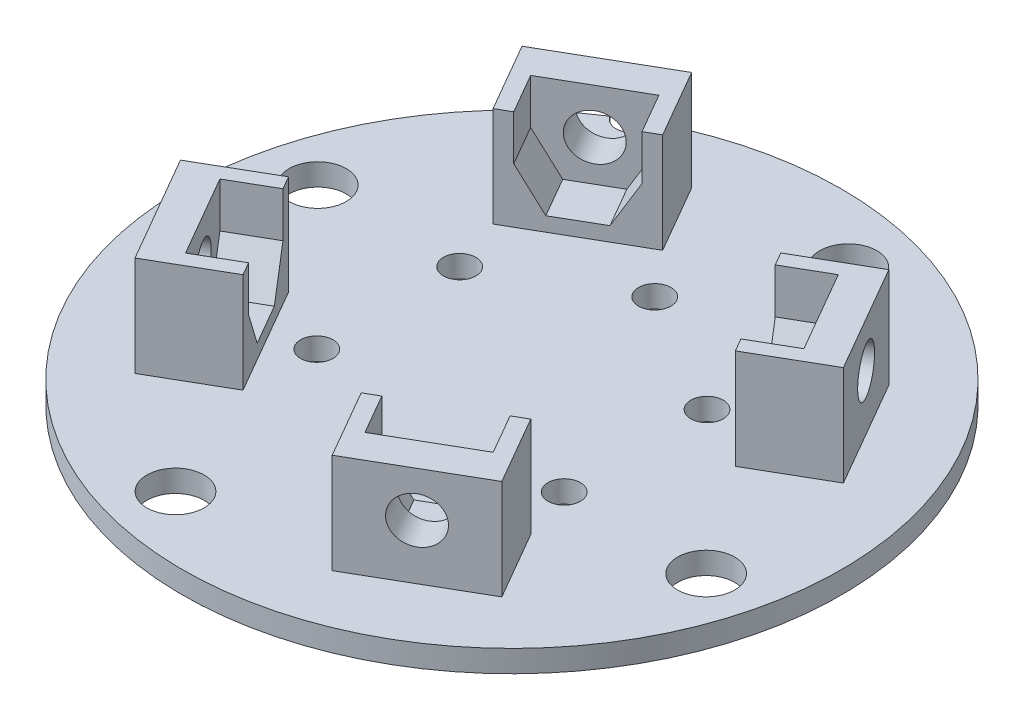
from build123d import *

# Parameters (mm, degrees)
SKETCH1_R           = 30
SKETCH1_R_2         = 1.475
SKETCH1_R_3         = 2.6
BOSS_EXTRUDE1_DEPTH = 2
SKETCH2_R           = 1.5
CUT_EXTRUDE1_DEPTH  = 10
BOSS_EXTRUDE3_DEPTH = 9.1
CIRPATTERN1_COUNT   = 4
CUT_EXTRUDE2_START  = -3
CUT_EXTRUDE2_DEPTH  = 5
CUT_EXTRUDE3_DEPTH  = 15
CIRPATTERN2_COUNT   = 4
CIRPATTERN3_COUNT   = 4


with BuildPart() as part:
    # Sketch1 → Boss-Extrude1 (new body)
    with BuildSketch(Plane(origin=(0, 0, 0), x_dir=(1, 0, 0), z_dir=(0, 1, 0))):
        with Locations(Location((0, 0, 0), (0, 0, 270))):
            Circle(SKETCH1_R)
        with Locations(Location((0, 13, 0), (0, 0, 270))):
            Circle(SKETCH1_R_2, mode=Mode.SUBTRACT)
        with Locations(Location((11.258330249, 6.5, 0), (0, 0, 270))):
            Circle(SKETCH1_R_2, mode=Mode.SUBTRACT)
        with Locations(Location((11.258330249, -6.5, 0), (0, 0, 270))):
            Circle(SKETCH1_R_2, mode=Mode.SUBTRACT)
        with Locations(Location((0, -13, 0), (0, 0, 270))):
            Circle(SKETCH1_R_2, mode=Mode.SUBTRACT)
        with Locations(Location((-11.258330249, -6.5, 0), (0, 0, 270))):
            Circle(SKETCH1_R_2, mode=Mode.SUBTRACT)
        with Locations(Location((-11.258330249, 6.5, 0), (0, 0, 270))):
            Circle(SKETCH1_R_2, mode=Mode.SUBTRACT)
        with Locations(Location((-24.148145657, 6.470476128, 0), (0, 0, 270))):
            Circle(SKETCH1_R_3, mode=Mode.SUBTRACT)
        with Locations(Location((6.470476128, 24.148145657, 0), (0, 0, 270))):
            Circle(SKETCH1_R_3, mode=Mode.SUBTRACT)
        with Locations(Location((24.148145657, -6.470476128, 0), (0, 0, 270))):
            Circle(SKETCH1_R_3, mode=Mode.SUBTRACT)
        with Locations(Location((-6.470476128, -24.148145657, 0), (0, 0, 270))):
            Circle(SKETCH1_R_3, mode=Mode.SUBTRACT)
    extrude(amount=BOSS_EXTRUDE1_DEPTH)

    # Sketch2 → Cut-Extrude1 (cut)
    with BuildSketch(Plane(origin=(0, 2, 0), x_dir=(1, 0, 0), z_dir=(0, 1, 0))):
        with Locations((-15, 25.980762114)):
            Circle(SKETCH2_R)
    extrude(amount=-CUT_EXTRUDE1_DEPTH, mode=Mode.SUBTRACT)

    # Sketch8 → Boss-Extrude3 (add)
    with BuildSketch(Plane(origin=(0, 2, 0), x_dir=(1, 0, 0), z_dir=(0, 1, 0))):
        Polygon((-6.906956469, 23.263199529), (-11.8, 20.438199529), (-8.2, 14.202816622), (-3.306956469, 17.027816622), align=None)
        Polygon((-8.2, 14.202816622), (-11.8, 20.438199529), (-16.693043531, 17.613199529), (-13.093043531, 11.377816622), align=None)
    boss_extrude3 = extrude(amount=BOSS_EXTRUDE3_DEPTH)

    # CirPattern1: Boss-Extrude3 ×4 about axis
    cirpattern1_axis = Axis((0, 0, 0), (0, 1, 0))
    for i in range(1, CIRPATTERN1_COUNT):
        add(boss_extrude3.rotate(cirpattern1_axis, i * 360 / CIRPATTERN1_COUNT))

    # Sketch9 → Cut-Extrude2 (cut)
    with BuildSketch(Plane(origin=(-11.8, 0, -20.438199529), x_dir=(-0.8660254037844384, 0, 0.5000000000000006), z_dir=(-0.5000000000000006, 0, -0.8660254037844384)).offset(CUT_EXTRUDE2_START)):
        Polygon((0, 3.3), (0, 10.7), (-2.136195996, 10.7), (-4.272391992, 7), (-2.136195996, 3.3), align=None)
        Polygon((2.136195996, 10.7), (0, 10.7), (0, 3.3), (2.136195996, 3.3), (4.272391992, 7), align=None)
        Polygon((0, 10.7), (0, 11.1), (-4.272391992, 11.1), (-4.272391992, 7), (-2.136195996, 10.7), align=None)
        Polygon((4.272391992, 11.1), (0, 11.1), (0, 10.7), (2.136195996, 10.7), (4.272391992, 7), align=None)
    cut_extrude2 = extrude(amount=-CUT_EXTRUDE2_DEPTH, mode=Mode.SUBTRACT)

    # Sketch10 → Cut-Extrude3 (cut)
    with BuildSketch(Plane(origin=(-11.8, 0, -20.438199529), x_dir=(-0.8660254037844384, 0, 0.5000000000000006), z_dir=(-0.5000000000000006, 0, -0.8660254037844384))):
        with BuildLine():
            ThreePointArc((2.1, 7), (1.48492424, 8.48492424), (0, 9.1))
            Line((0, 9.1), (0, 4.9))
            ThreePointArc((0, 4.9), (1.48492424, 5.51507576), (2.1, 7))
        make_face()
        with BuildLine():
            Line((0, 4.9), (0, 9.1))
            ThreePointArc((0, 9.1), (-2.1, 7), (0, 4.9))
        make_face()
    cut_extrude3 = extrude(amount=-CUT_EXTRUDE3_DEPTH, mode=Mode.SUBTRACT)

    # CirPattern2: Cut-Extrude2 ×4 about axis
    cirpattern2_axis = Axis((0, 0, 0), (0, 1, 0))
    for i in range(1, CIRPATTERN2_COUNT):
        add(cut_extrude2.rotate(cirpattern2_axis, i * 360 / CIRPATTERN2_COUNT), mode=Mode.SUBTRACT)

    # CirPattern3: Cut-Extrude3 ×4 about axis
    cirpattern3_axis = Axis((0, 2, 0), (0, 1, 0))
    for i in range(1, CIRPATTERN3_COUNT):
        add(cut_extrude3.rotate(cirpattern3_axis, i * 360 / CIRPATTERN3_COUNT), mode=Mode.SUBTRACT)


solid = part.part
